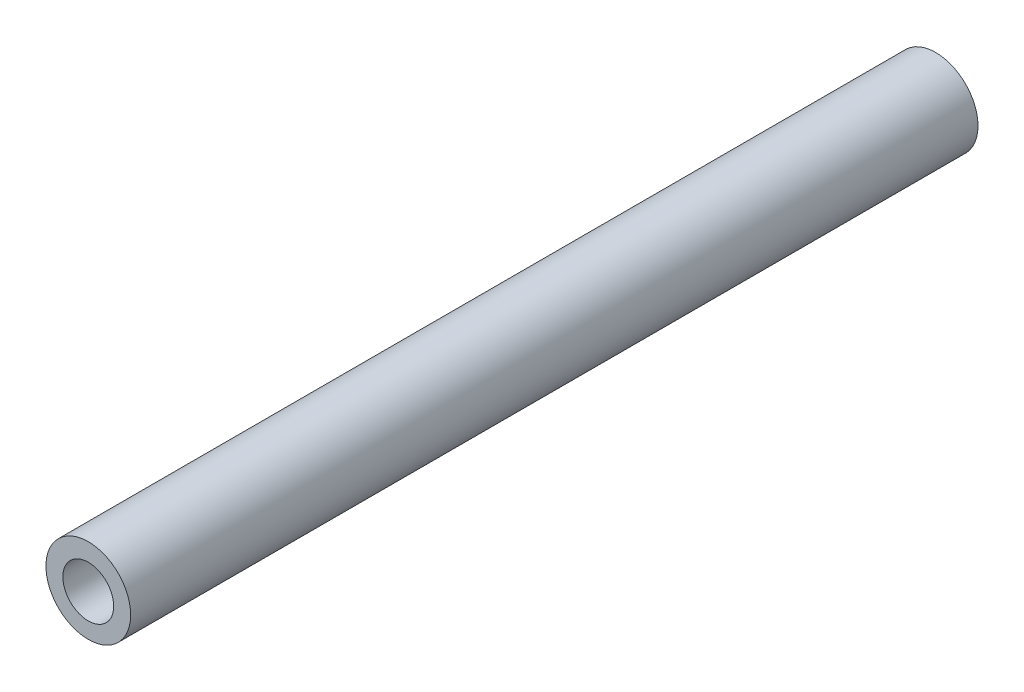
from build123d import *

# Parameters (mm, degrees)
SKETCH1_R           = 5
SKETCH1_R_2         = 3
BOSS_EXTRUDE1_DEPTH = 100


with BuildPart() as part:
    # Sketch1 → Boss-Extrude1 (new body)
    with BuildSketch(Plane.XY):
        with Locations((0.052288579, 0.183010026)):
            Circle(SKETCH1_R)
        with Locations((0.052288579, 0.078432868)):
            Circle(SKETCH1_R_2, mode=Mode.SUBTRACT)
    extrude(amount=BOSS_EXTRUDE1_DEPTH)


solid = part.part
